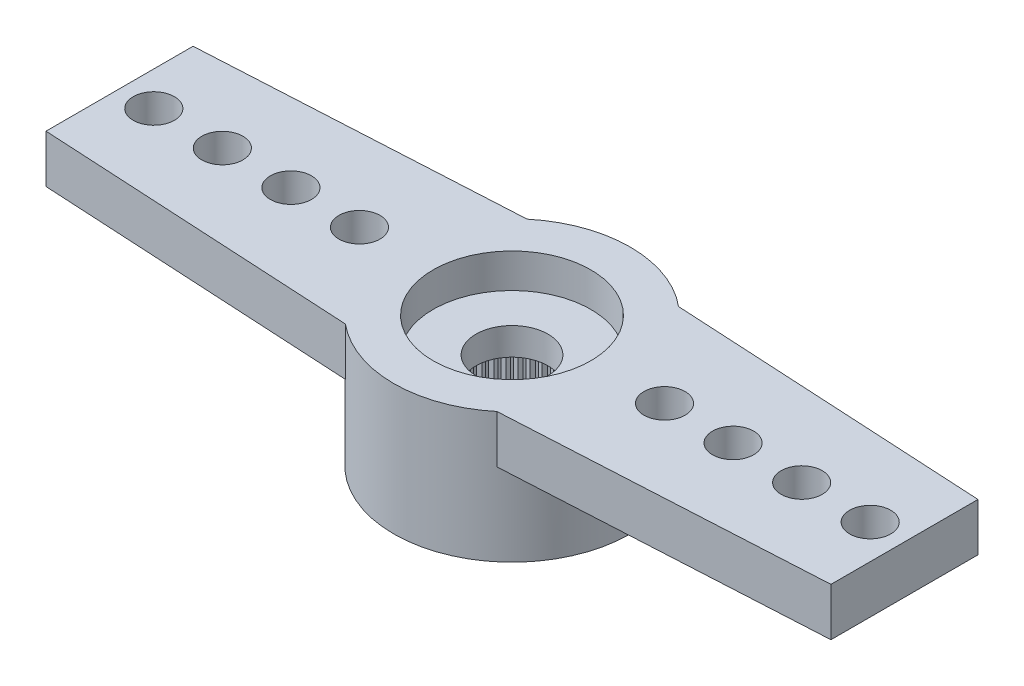
from build123d import *

# Parameters (mm, degrees)
RESSALTO_EXTRUS_O1_DEPTH = 1.4
ESBO_O2_R                = 3.45
RESSALTO_EXTRUS_O2_DEPTH = 2.4
FURO4_D                  = 1.2
PADR_O_LINEAR1_COUNT     = 6
PADR_O_LINEAR1_PITCH     = 2
PADR_OCIRCULAR2_COUNT    = 2
PADR_OCIRCULAR2_COPY_1_D = 1.2
PADR_OCIRCULAR2_COPY_2_D = 1.2
PADR_OCIRCULAR2_COPY_3_D = 1.2
PADR_OCIRCULAR2_COPY_4_D = 1.2
PADR_OCIRCULAR2_COPY_5_D = 1.2
FURO1_D                  = 4.95
FURO1_DEPTH              = 2
FURO2_D                  = 4.6
FURO2_DEPTH              = 1
FURO3_D                  = 2.1
RESSALTO_EXTRUS_O3_START = -2
RESSALTO_EXTRUS_O3_DEPTH = 2
PADR_OCIRCULAR1_COUNT    = 60
CUT_EXTRUDE2_START       = -10
CUT_EXTRUDE2_DEPTH       = 10


with BuildPart() as part:
    # Esboço1 → Ressalto-extrusão1 (new body)
    with BuildSketch(Plane(origin=(0, 0, 0), x_dir=(1, 0, 0), z_dir=(0, 1, 0))):
        with BuildLine():
            Line((-14.159121967, 1.99702088), (-2.209072203, 2.65))
            ThreePointArc((-2.209072203, 2.65), (3.45, 0), (-2.209072203, -2.65))
            Line((-2.209072203, -2.65), (-14.159121967, -1.99702088))
            ThreePointArc((-14.159121967, -1.99702088), (-16.05, 0), (-14.159121967, 1.99702088))
        make_face()
    ressalto_extrus_o1 = extrude(amount=-RESSALTO_EXTRUS_O1_DEPTH)

    # Esboço2 → Ressalto-extrusão2 (add)
    with BuildSketch(Plane.XZ.offset(1.4)):
        with Locations(Location((0, 0, 0), (0, 0, 90))):
            Circle(ESBO_O2_R)
    extrude(amount=RESSALTO_EXTRUS_O2_DEPTH)

    # Furo4 (through all)
    with Locations(Plane(origin=(0, 0, 0), x_dir=(1, 0, 0), z_dir=(0, 1, 0))):
        with Locations((-14.45, 0)):
            furo4 = Hole(FURO4_D / 2)

    # Padrão linear1: Furo4 ×6
    with Locations(*[(i * PADR_O_LINEAR1_PITCH, 0, 0) for i in range(1, PADR_O_LINEAR1_COUNT)]):
        add(furo4, mode=Mode.SUBTRACT)

    # PadrãoCircular2: Ressalto-extrusão1, Furo4 ×2 about axis
    padr_ocircular2_axis = Axis((0, 0, 0), (0, 1, 0))
    add([ressalto_extrus_o1.rotate(padr_ocircular2_axis, i * 360 / PADR_OCIRCULAR2_COUNT) for i in range(1, PADR_OCIRCULAR2_COUNT)])
    add([furo4.rotate(padr_ocircular2_axis, i * 360 / PADR_OCIRCULAR2_COUNT) for i in range(1, PADR_OCIRCULAR2_COUNT)], mode=Mode.SUBTRACT)

    # PadrãoCircular2 copy 1 (through all)
    with Locations(Plane(origin=(-2, 0, 0), x_dir=(-1, 0, 0), z_dir=(0, 1, 0))):
        with Locations((-14.45, 0)):
            Hole(PADR_OCIRCULAR2_COPY_1_D / 2)

    # PadrãoCircular2 copy 2 (through all)
    with Locations(Plane(origin=(-4, 0, 0), x_dir=(-1, 0, 0), z_dir=(0, 1, 0))):
        with Locations((-14.45, 0)):
            Hole(PADR_OCIRCULAR2_COPY_2_D / 2)

    # PadrãoCircular2 copy 3 (through all)
    with Locations(Plane(origin=(-6, 0, 0), x_dir=(-1, 0, 0), z_dir=(0, 1, 0))):
        with Locations((-14.45, 0)):
            Hole(PADR_OCIRCULAR2_COPY_3_D / 2)

    # PadrãoCircular2 copy 4 (through all)
    with Locations(Plane(origin=(-8, 0, 0), x_dir=(-1, 0, 0), z_dir=(0, 1, 0))):
        with Locations((-14.45, 0)):
            Hole(PADR_OCIRCULAR2_COPY_4_D / 2)

    # PadrãoCircular2 copy 5 (through all)
    with Locations(Plane(origin=(-10, 0, 0), x_dir=(-1, 0, 0), z_dir=(0, 1, 0))):
        with Locations((-14.45, 0)):
            Hole(PADR_OCIRCULAR2_COPY_5_D / 2)

    # Furo1
    with Locations(Plane(origin=(0, -3.8, 0), x_dir=(-1, 0, 0), z_dir=(0, -1, 0))):
        with Locations((0, 0)):
            Hole(FURO1_D / 2, depth=FURO1_DEPTH)

    # Furo2
    with Locations(Plane(origin=(0, 0, 0), x_dir=(1, 0, 0), z_dir=(0, 1, 0))):
        with Locations((0, 0)):
            Hole(FURO2_D / 2, depth=FURO2_DEPTH)

    # Furo3 (through all)
    with Locations(Plane(origin=(0, 0, 0), x_dir=(1, 0, 0), z_dir=(0, 1, 0))):
        with Locations((0, 0)):
            Hole(FURO3_D / 2)

    # Esboço11 → Ressalto-extrusão3 (add)
    with BuildSketch(Plane.XZ.offset(3.8).offset(RESSALTO_EXTRUS_O3_START)):
        with BuildLine():
            Line((-0.098056786, 2.473056786), (0, 2.375))
            Line((0, 2.375), (0.098056786, 2.473056786))
            ThreePointArc((0.098056786, 2.473056786), (0, 2.475), (-0.098056786, 2.473056786))
        make_face()
    ressalto_extrus_o3 = extrude(amount=RESSALTO_EXTRUS_O3_DEPTH)

    # PadrãoCircular1: Ressalto-extrusão3 ×60 about axis
    padr_ocircular1_axis = Axis((0, 0, 0), (0, 1, 0))
    for i in range(1, PADR_OCIRCULAR1_COUNT):
        add(ressalto_extrus_o3.rotate(padr_ocircular1_axis, i * 360 / PADR_OCIRCULAR1_COUNT))

    # Sketch2 → Cut-Extrude2 (cut)
    with BuildSketch(Plane(origin=(0, 0, 0), x_dir=(1, 0, 0), z_dir=(0, 1, 0)).offset(CUT_EXTRUDE2_START)):
        with BuildLine():
            ThreePointArc((14.159121967, -1.99702088), (15.502281642, -1.375092009), (16.05, 0))
            Line((16.05, 0), (15.05, 0))
            ThreePointArc((15.05, 0), (14.45, -0.6), (13.85, 0))
            Line((13.85, 0), (13.05, 0))
            ThreePointArc((13.05, 0), (12.45, -0.6), (11.85, 0))
            Line((11.85, 0), (11.45, 0))
            Line((11.45, 0), (11.45, -2.145053743))
            Line((11.45, -2.145053743), (14.159121967, -1.99702088))
        make_face()
        with BuildLine():
            Line((-14.159121967, 1.99702088), (-11.45, 2.145053743))
            Line((-11.45, 2.145053743), (-17.501372269, 2.145053743))
            Line((-17.501372269, 2.145053743), (-18.074774731, -1.783060307))
            Line((-18.074774731, -1.783060307), (-14.159121967, -1.99702088))
            ThreePointArc((-14.159121967, -1.99702088), (-15.502281642, -1.375092009), (-16.05, 0))
            ThreePointArc((-16.05, 0), (-15.502281642, 1.375092009), (-14.159121967, 1.99702088))
        make_face()
        with BuildLine():
            Line((-11.85, 0), (-11.45, 0))
            Line((-11.45, 0), (-11.45, 2.145053743))
            Line((-11.45, 2.145053743), (-14.159121967, 1.99702088))
            ThreePointArc((-14.159121967, 1.99702088), (-15.502281642, 1.375092009), (-16.05, 0))
            Line((-16.05, 0), (-15.05, 0))
            ThreePointArc((-15.05, 0), (-14.45, 0.6), (-13.85, 0))
            Line((-13.85, 0), (-13.05, 0))
            ThreePointArc((-13.05, 0), (-12.45, 0.6), (-11.85, 0))
        make_face()
        with BuildLine():
            Line((-11.45, -2.145053743), (-11.45, 0))
            Line((-11.45, 0), (-11.85, 0))
            ThreePointArc((-11.85, 0), (-12.45, -0.6), (-13.05, 0))
            Line((-13.05, 0), (-13.85, 0))
            ThreePointArc((-13.85, 0), (-14.45, -0.6), (-15.05, 0))
            Line((-15.05, 0), (-16.05, 0))
            ThreePointArc((-16.05, 0), (-15.502281642, -1.375092009), (-14.159121967, -1.99702088))
            Line((-14.159121967, -1.99702088), (-11.45, -2.145053743))
        make_face()
        with BuildLine():
            Line((15.05, 0), (16.05, 0))
            ThreePointArc((16.05, 0), (15.502281642, 1.375092009), (14.159121967, 1.99702088))
            Line((14.159121967, 1.99702088), (11.45, 2.145053743))
            Line((11.45, 2.145053743), (11.45, 0))
            Line((11.45, 0), (11.85, 0))
            ThreePointArc((11.85, 0), (12.45, 0.6), (13.05, 0))
            Line((13.05, 0), (13.85, 0))
            ThreePointArc((13.85, 0), (14.45, 0.6), (15.05, 0))
        make_face()
    extrude(amount=CUT_EXTRUDE2_DEPTH, mode=Mode.SUBTRACT)


solid = part.part
